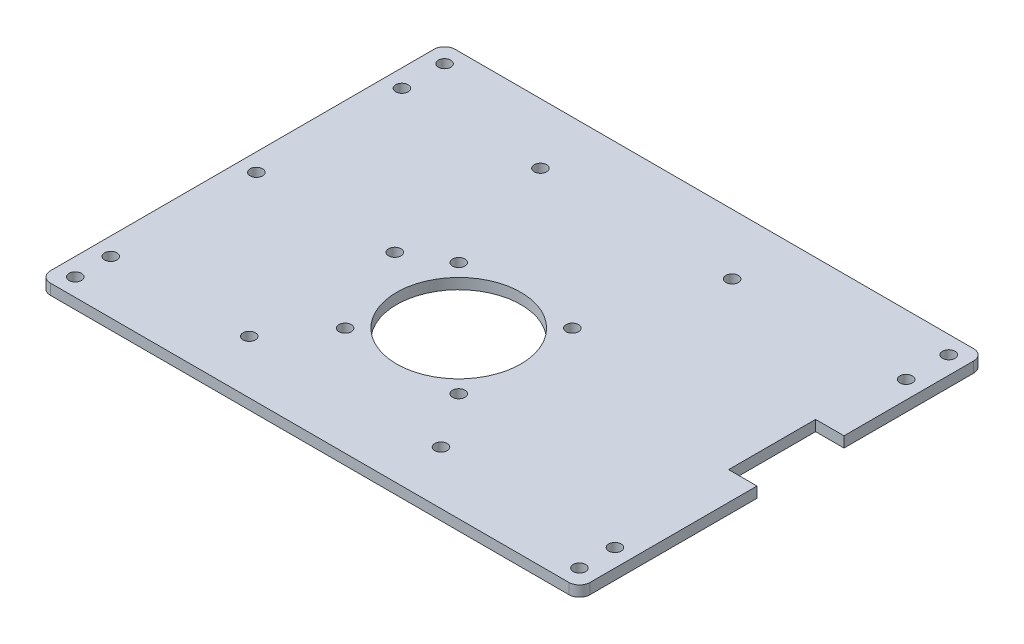
from build123d import *

# Parameters (mm, degrees)
SKETCH_1_R      = 1.75
SKETCH_1_R_2    = 17.5
EXTRUDE_1_DEPTH = 3


with BuildPart() as part:
    # 草图1 → 凸台-拉伸1 (new body)
    with BuildSketch(Plane(origin=(0, 0, 0), x_dir=(1, 0, 0), z_dir=(0, 1, 0))):
        with BuildLine():
            Line((76, 17.5), (68, 17.5))
            Line((68, 17.5), (68, -7))
            Line((68, -7), (76, -7))
            Line((76, -7), (76, -54))
            ThreePointArc((76, -54), (75.121320344, -56.121320344), (73, -57))
            Line((73, -57), (-73, -57))
            ThreePointArc((-73, -57), (-75.121320344, -56.121320344), (-76, -54))
            Line((-76, -54), (-76, 54))
            ThreePointArc((-76, 54), (-75.121320344, 56.121320344), (-73, 57))
            Line((-73, 57), (73, 57))
            ThreePointArc((73, 57), (75.121320344, 56.121320344), (76, 54))
            Line((76, 54), (76, 17.5))
        make_face()
        with Locations(Location((-71, 52, 0), (0, 0, 270))):
            Circle(SKETCH_1_R, mode=Mode.SUBTRACT)
        with Locations(Location((71, 52, 0), (0, 0, 270))):
            Circle(SKETCH_1_R, mode=Mode.SUBTRACT)
        with Locations(Location((71, -52, 0), (0, 0, 270))):
            Circle(SKETCH_1_R, mode=Mode.SUBTRACT)
        with Locations(Location((-71, -52, 0), (0, 0, 270))):
            Circle(SKETCH_1_R, mode=Mode.SUBTRACT)
        with Locations(Location((-4.5, -10.5, 0), (0, 0, 270))):
            Circle(SKETCH_1_R_2, mode=Mode.SUBTRACT)
        with Locations(Location((-20.5, 5.5, 0), (0, 0, 270))):
            Circle(SKETCH_1_R, mode=Mode.SUBTRACT)
        with Locations(Location((11.5, 5.5, 0), (0, 0, 270))):
            Circle(SKETCH_1_R, mode=Mode.SUBTRACT)
        with Locations(Location((11.5, -26.5, 0), (0, 0, 270))):
            Circle(SKETCH_1_R, mode=Mode.SUBTRACT)
        with Locations(Location((-20.5, -26.5, 0), (0, 0, 270))):
            Circle(SKETCH_1_R, mode=Mode.SUBTRACT)
        with Locations(Location((71, 40, 0), (0, 0, 270))):
            Circle(SKETCH_1_R, mode=Mode.SUBTRACT)
        with Locations(Location((22, 40, 0), (0, 0, 270))):
            Circle(SKETCH_1_R, mode=Mode.SUBTRACT)
        with Locations(Location((22, -42, 0), (0, 0, 270))):
            Circle(SKETCH_1_R, mode=Mode.SUBTRACT)
        with Locations(Location((71, -42, 0), (0, 0, 270))):
            Circle(SKETCH_1_R, mode=Mode.SUBTRACT)
        with Locations(Location((-71, 40, 0), (0, 0, 90))):
            Circle(SKETCH_1_R, mode=Mode.SUBTRACT)
        with Locations(Location((-32, 40, 0), (0, 0, 90))):
            Circle(SKETCH_1_R, mode=Mode.SUBTRACT)
        with Locations(Location((-32, -1, 0), (0, 0, 90))):
            Circle(SKETCH_1_R, mode=Mode.SUBTRACT)
        with Locations(Location((-32, -42, 0), (0, 0, 90))):
            Circle(SKETCH_1_R, mode=Mode.SUBTRACT)
        with Locations(Location((-71, -1, 0), (0, 0, 90))):
            Circle(SKETCH_1_R, mode=Mode.SUBTRACT)
        with Locations(Location((-71, -42, 0), (0, 0, 90))):
            Circle(SKETCH_1_R, mode=Mode.SUBTRACT)
    extrude(amount=EXTRUDE_1_DEPTH)


solid = part.part
